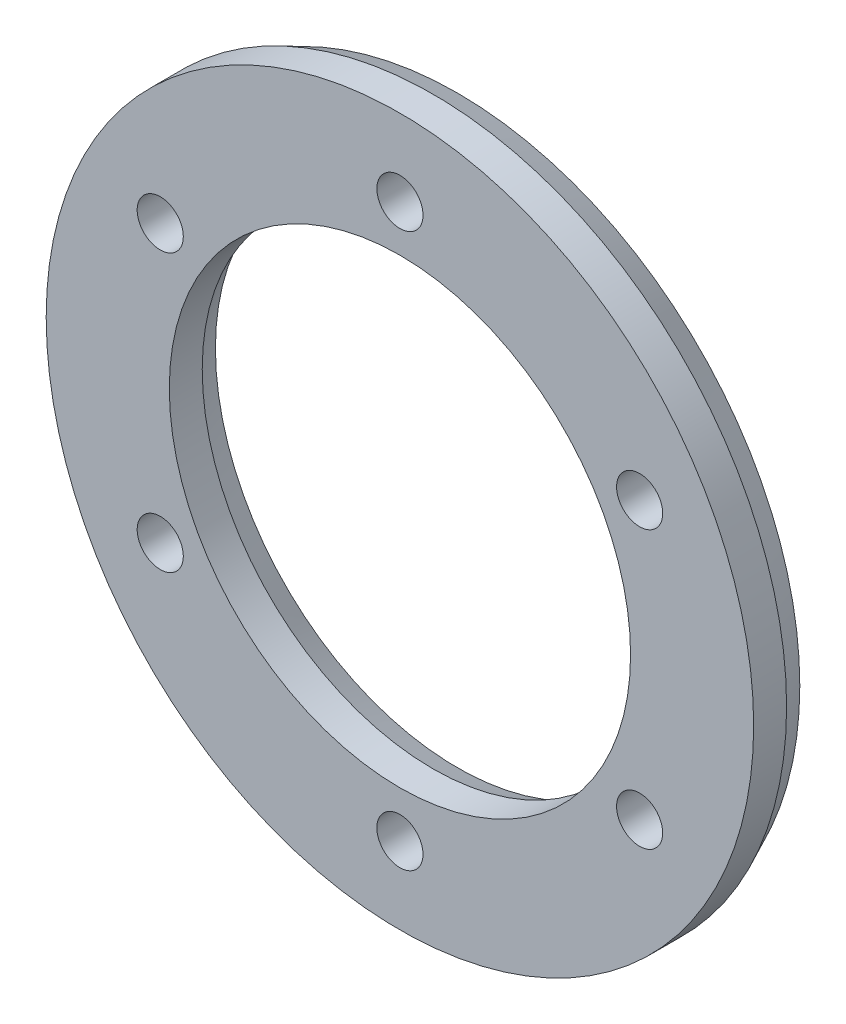
from build123d import *

# Parameters (mm, degrees)
SKETCH1_R           = 30.675
SKETCH1_R_2         = 2
SKETCH1_R_3         = 20
BOSS_EXTRUDE1_DEPTH = 5
CHAMFER6_SIZE       = 1
CHAMFER6_SIZE2      = 2.144506921


with BuildPart() as part:
    # Sketch1 → Boss-Extrude1 (new body)
    with BuildSketch(Plane.XY):
        Circle(SKETCH1_R)
        with Locations((0, 24)):
            Circle(SKETCH1_R_2, mode=Mode.SUBTRACT)
        Circle(SKETCH1_R_3, mode=Mode.SUBTRACT)
        with Locations((20.784609691, 12)):
            Circle(SKETCH1_R_2, mode=Mode.SUBTRACT)
        with Locations((20.784609691, -12)):
            Circle(SKETCH1_R_2, mode=Mode.SUBTRACT)
        with Locations((0, -24)):
            Circle(SKETCH1_R_2, mode=Mode.SUBTRACT)
        with Locations((-20.784609691, -12)):
            Circle(SKETCH1_R_2, mode=Mode.SUBTRACT)
        with Locations((-20.784609691, 12)):
            Circle(SKETCH1_R_2, mode=Mode.SUBTRACT)
    extrude(amount=BOSS_EXTRUDE1_DEPTH)

    # Chamfer6
    chamfer6_edges = [part.edges().sort_by_distance(p)[0] for p in [
        (-30.675, 0, 0),
        (-20, 0, 0),
    ]]
    chamfer6_side = [part.faces().sort_by_distance(p)[0] for p in [
        (-29.807379979, 0, 0),
    ]]
    chamfer(chamfer6_edges, length=CHAMFER6_SIZE, length2=CHAMFER6_SIZE2, reference=chamfer6_side[0])


solid = part.part
